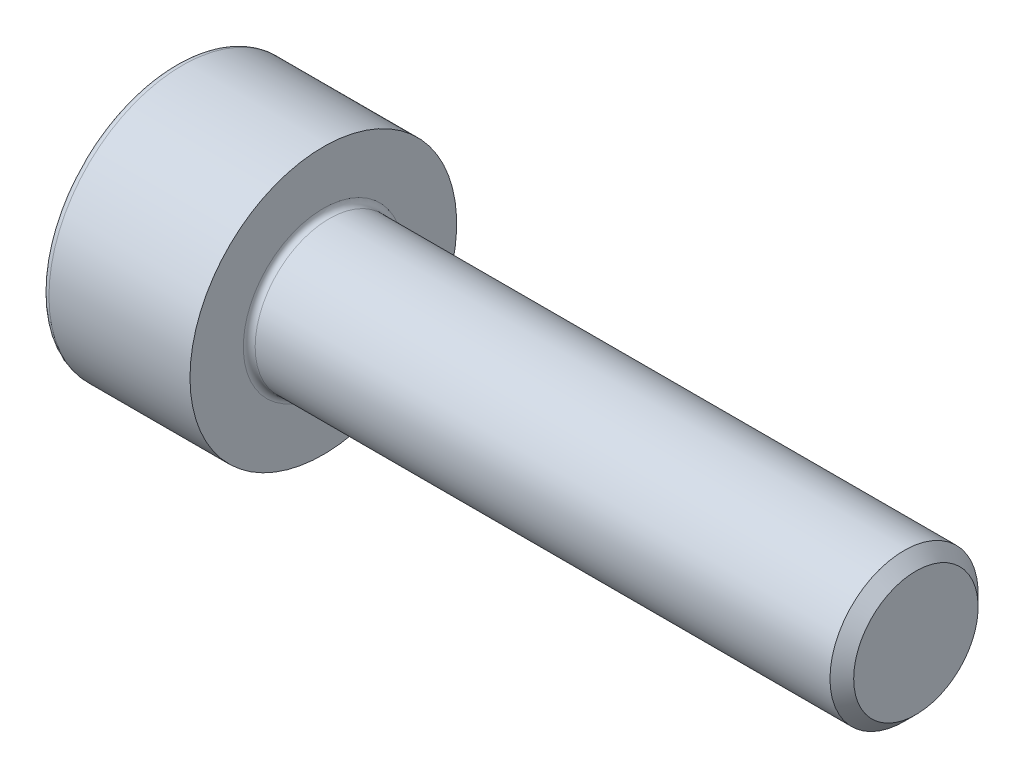
from build123d import *

# Parameters (mm, degrees)
FILLET1_R      = 0.1
FILLET2_R      = 0.12
CHAMFER1_SIZE  = 0.2
EXTRUDE1_DEPTH = 1


with BuildPart() as part:
    # Sketch1 → Revolve1 (revolve)
    with BuildSketch(Plane.XY, mode=Mode.PRIVATE) as revolve1_sk:
        Polygon((2.5, 1.25), (2.5, 0), (4.279914881, 0), (12.5, 0), (12.5, 1.25), align=None)
        Polygon((0, 2.25), (0, 0), (2.5, 0), (2.5, 1.25), (2.5, 2.25), align=None)
    revolve(revolve1_sk.sketch.rotate(Axis((0, 0, 0), (1, 0, 0)), 90), axis=Axis((0, 0, 0), (1, 0, 0)))

    # Fillet1
    fillet1_edges = [part.edges().sort_by_distance(p)[0] for p in [
        (2.5, 0, -1.25),
    ]]
    fillet(fillet1_edges, radius=FILLET1_R)

    # Fillet2
    fillet2_edges = [part.edges().sort_by_distance(p)[0] for p in [
        (0, 0, -2.25),
    ]]
    fillet(fillet2_edges, radius=FILLET2_R)

    # Chamfer1
    chamfer1_edges = [part.edges().sort_by_distance(p)[0] for p in [
        (12.5, 0, -1.25),
    ]]
    chamfer(chamfer1_edges, length=CHAMFER1_SIZE)

    # Sketch2 → Extrude1 (cut)
    with BuildSketch(Plane.ZY):
        Polygon((0, 1.154700538), (-1, 0.577350269), (-1, -0.577350269), (0, -1.154700538), (1, -0.577350269), (1, 0.577350269), align=None)
    extrude(amount=-EXTRUDE1_DEPTH, mode=Mode.SUBTRACT)


solid = part.part
